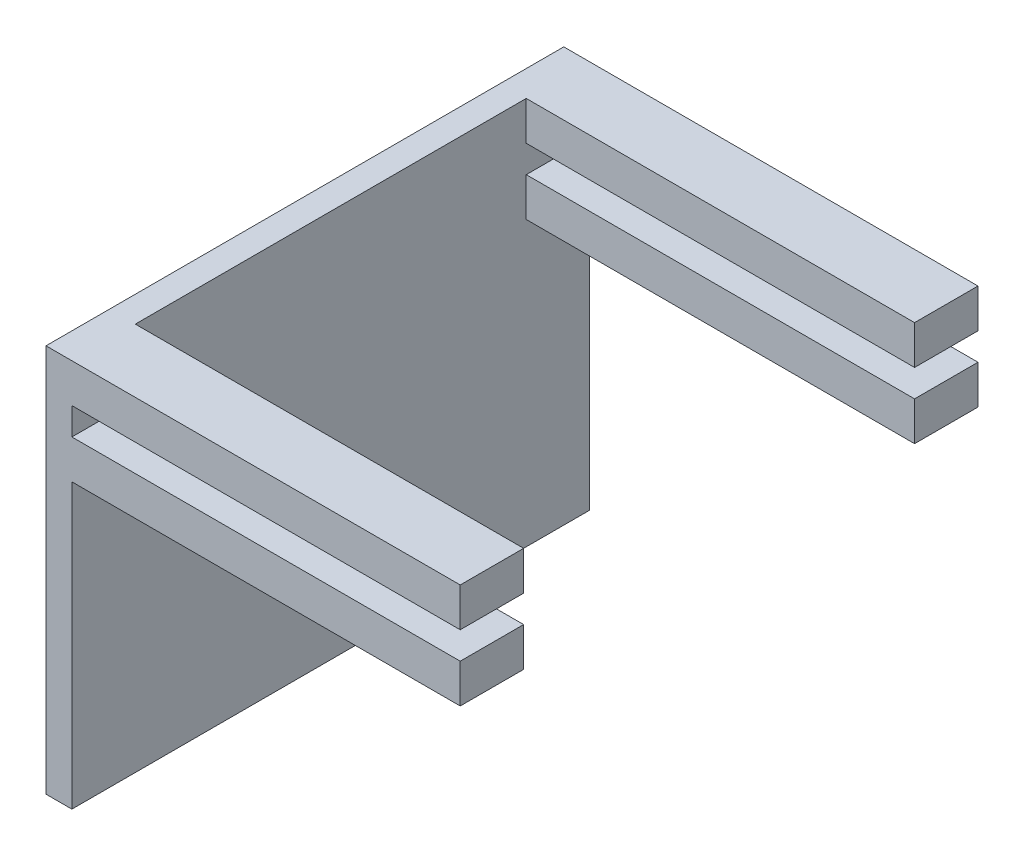
from build123d import *

# Parameters (mm, degrees)
SKICA1_W                = 2
SKICA1_H                = 30
P_IDAT_VYSUNUT_M1_DEPTH = 40
SKICA2_W                = 4.9
SKICA2_H                = 3
P_IDAT_VYSUNUT_M2_DEPTH = 30
P_IDAT_VYSUNUT_M3_DEPTH = 2


with BuildPart() as part:
    # Skica1 → Přidat vysunutím1 (new body)
    with BuildSketch(Plane.XY):
        with Locations((1, 15)):
            Rectangle(SKICA1_W, SKICA1_H)
    extrude(amount=P_IDAT_VYSUNUT_M1_DEPTH)

    # Skica2 → Přidat vysunutím2 (add)
    with BuildSketch(Plane(origin=(2, 0, 0), x_dir=(0, 0, -1), z_dir=(1, 0, 0))):
        with Locations((-37.55, 28.5)):
            Rectangle(SKICA2_W, SKICA2_H)
        with Locations((-2.45, 28.5)):
            Rectangle(SKICA2_W, SKICA2_H)
        with Locations((-37.55, 23.4)):
            Rectangle(SKICA2_W, SKICA2_H)
        with Locations((-2.45, 23.4)):
            Rectangle(SKICA2_W, SKICA2_H)
    extrude(amount=P_IDAT_VYSUNUT_M2_DEPTH)

    # Skica3 → Přidat vysunutím3 (add)
    with BuildSketch(Plane(origin=(0, 0, 0), x_dir=(-1, 0, 0), z_dir=(0, 0, -1))):
        with BuildLine():
            ThreePointArc((0, 14), (1, 15), (2, 14))
            Line((2, 14), (2, 4))
            ThreePointArc((2, 4), (1, 3), (0, 4))
            Line((0, 4), (0, 1.171572875))
            ThreePointArc((0, 1.171572875), (2.732050808, 1.550510257), (4, 4))
            Line((4, 4), (4, 14))
            ThreePointArc((4, 14), (2.732050808, 16.449489743), (0, 16.828427125))
            Line((0, 16.828427125), (0, 14))
        make_face()
    extrude(amount=-P_IDAT_VYSUNUT_M3_DEPTH)


solid = part.part
